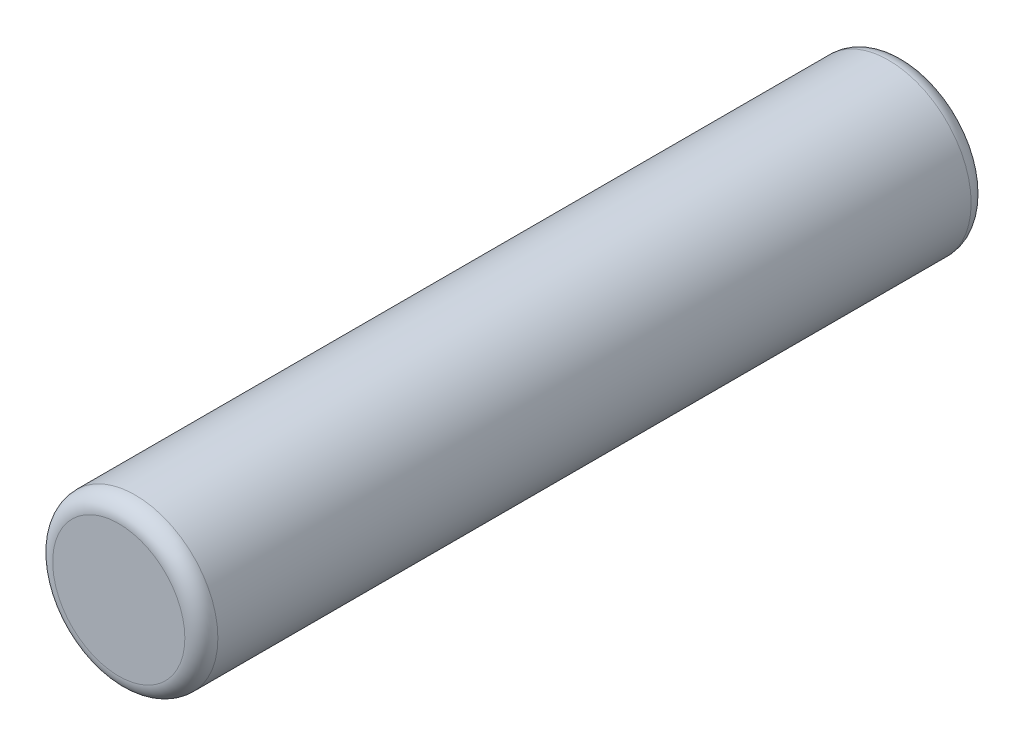
from build123d import *

# Parameters (mm, degrees)
ESQUISSE1_R          = 2.5
BASE_EXTRUSION_DEPTH = 23.8
CONG_1_R             = 0.5


with BuildPart() as part:
    # Esquisse1 → Base-Extrusion (new body)
    with BuildSketch(Plane.XY):
        Circle(ESQUISSE1_R)
    extrude(amount=BASE_EXTRUSION_DEPTH)

    # Congé1
    cong_1_edges = [part.edges().sort_by_distance(p)[0] for p in [
        (-2.5, 0, 0),
        (-2.5, 0, 23.8),
    ]]
    fillet(cong_1_edges, radius=CONG_1_R)


solid = part.part
